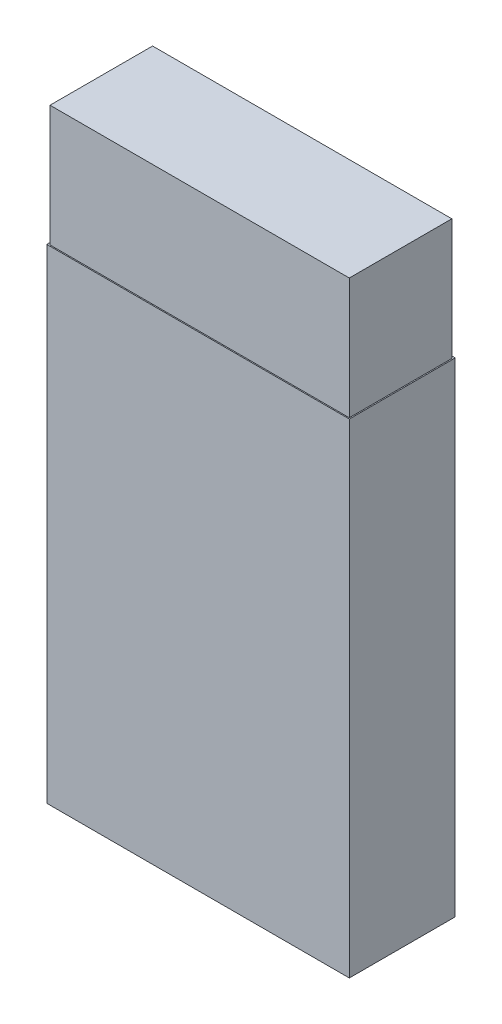
from build123d import *

# Parameters (mm, degrees)
SKETCH1_W           = 10
SKETCH1_H           = 16
BOSS_EXTRUDE1_DEPTH = 3.5
SKETCH3_W           = 9.891365743
SKETCH3_H           = 3.389710688
BOSS_EXTRUDE4_DEPTH = 4


with BuildPart() as part:
    # Sketch1 → Boss-Extrude1 (new body)
    with BuildSketch(Plane.XY):
        with Locations((-3.139534884, 3.930232558)):
            Rectangle(SKETCH1_W, SKETCH1_H)
    extrude(amount=BOSS_EXTRUDE1_DEPTH)

    # Sketch3 → Boss-Extrude4 (add)
    with BuildSketch(Plane(origin=(0, 11.930232558, 0), x_dir=(1, 0, 0), z_dir=(0, 1, 0))):
        with Locations((-3.122896663, -1.768946669)):
            Rectangle(SKETCH3_W, SKETCH3_H)
    extrude(amount=BOSS_EXTRUDE4_DEPTH)


solid = part.part
